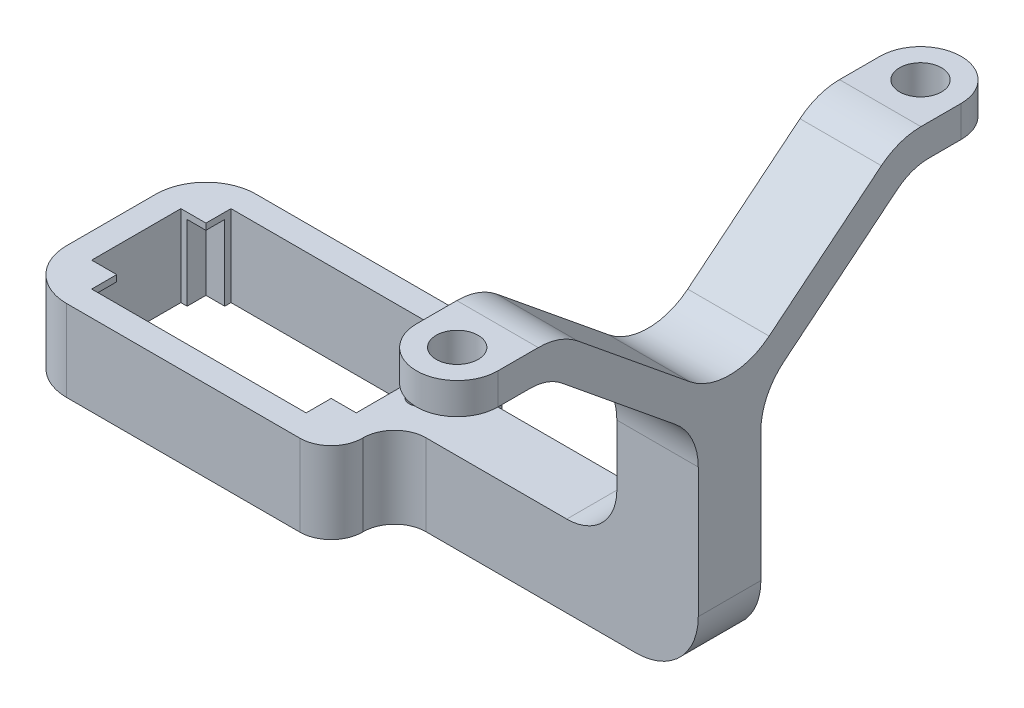
from build123d import *

# Parameters (mm, degrees)
BOSS_EXTRUDE1_DEPTH                   = 1
BOSS_EXTRUDE1_DEPTH_BACK              = 12
SKETCH1_W                             = 50.25
SKETCH1_H                             = 30.25
BOSS_EXTRUDE2_DEPTH                   = 5
BOSS_EXTRUDE3_DEPTH                   = 5
SKETCH4_R                             = 3.35
CUT_EXTRUDE1_DEPTH                    = 10
SKETCH6_W                             = 4
SKETCH6_H                             = 4
BOSS_EXTRUDE4_DEPTH                   = 1
TAP_DRILL_FOR_M4X0_7_TAP1_D           = 3.3
TAP_DRILL_FOR_M4X0_7_TAP1_CSINK_D     = 3.35
TAP_DRILL_FOR_M4X0_7_TAP1_CSINK_ANGLE = 90
SKETCH13_W                            = 13
SKETCH13_H                            = 54
CUT_EXTRUDE2_DEPTH                    = 22
BOSS_EXTRUDE5_DEPTH                   = 13
FILLET1_R                             = 10
FILLET2_R                             = 8
FILLET3_R                             = 5
FILLET4_R                             = 8


with BuildPart() as part:
    # Sketch1 → Boss-Extrude1 (new, two sides: drawn at the far end of the back side and taken through both)
    with BuildSketch(Plane(origin=(0, 20.13, 0), x_dir=(1, 0, 0), z_dir=(0, 1, 0)).offset(-BOSS_EXTRUDE1_DEPTH_BACK)):
        Rectangle(SKETCH1_W, SKETCH1_H)
        Polygon((20.125, 10.125), (17.125, 10.125), (17.125, 11.125), (-17.125, 11.125), (-17.125, 10.125), (-20.125, 10.125), (-20.125, 7.125), (-21.125, 7.125), (-21.125, -7.125), (-20.125, -7.125), (-20.125, -10.125), (-17.125, -10.125), (-17.125, -11.125), (17.125, -11.125), (17.125, -10.125), (20.125, -10.125), (20.125, -7.125), (21.125, -7.125), (21.125, 7.125), (20.125, 7.125), align=None, mode=Mode.SUBTRACT)
    extrude(amount=BOSS_EXTRUDE1_DEPTH + BOSS_EXTRUDE1_DEPTH_BACK)

    # Sketch2 → Boss-Extrude2 (add, symmetric)
    with BuildSketch(Plane.XY):
        Polygon((25.125, 21.13), (60.625, 21.13), (60.625, 68.13), (73.625, 68.13), (73.625, 8.13), (25.125, 8.13), align=None)
    extrude(amount=BOSS_EXTRUDE2_DEPTH, both=True)

    # Sketch3 → Boss-Extrude3 (add)
    with BuildSketch(Plane(origin=(0, 68.13, 0), x_dir=(1, 0, 0), z_dir=(0, 1, 0))):
        with BuildLine():
            Line((73.625, 5), (73.625, 37))
            ThreePointArc((73.625, 37), (67.125, 43.5), (60.625, 37))
            Line((60.625, 37), (60.625, 5))
            Line((60.625, 5), (73.625, 5))
        make_face()
        with BuildLine():
            Line((73.625, -37), (73.625, -5))
            Line((73.625, -5), (60.625, -5))
            Line((60.625, -5), (60.625, -37))
            ThreePointArc((60.625, -37), (67.125, -43.5), (73.625, -37))
        make_face()
    extrude(amount=-BOSS_EXTRUDE3_DEPTH)

    # Sketch4 → Cut-Extrude1 (cut)
    with BuildSketch(Plane.XZ.offset(-63.13)):
        with Locations(Location((67.125, 37, 0), (0, 0, 270))):
            Circle(SKETCH4_R)
        with Locations(Location((67.125, -37, 0), (0, 0, 270))):
            Circle(SKETCH4_R)
    extrude(amount=-CUT_EXTRUDE1_DEPTH, mode=Mode.SUBTRACT)

    # Sketch6 → Boss-Extrude4 (add)
    with BuildSketch(Plane(origin=(0, 21.13, 0), x_dir=(1, 0, 0), z_dir=(0, 1, 0))):
        with Locations((19.125, 9.125)):
            Rectangle(SKETCH6_W, SKETCH6_H)
        with Locations((19.125, -9.125)):
            Rectangle(SKETCH6_W, SKETCH6_H)
        with Locations((-19.125, -9.125)):
            Rectangle(SKETCH6_W, SKETCH6_H)
        with Locations((-19.125, 9.125)):
            Rectangle(SKETCH6_W, SKETCH6_H)
    extrude(amount=-BOSS_EXTRUDE4_DEPTH)

    # Tap Drill for M4x0.7 Tap1 (through all)
    with Locations(Plane(origin=(0, 8.13, 0), x_dir=(-1, 0, 0), z_dir=(0, -1, 0))):
        with Locations((-24.125, 0)):
            CounterSinkHole(TAP_DRILL_FOR_M4X0_7_TAP1_D / 2, TAP_DRILL_FOR_M4X0_7_TAP1_CSINK_D / 2, counter_sink_angle=TAP_DRILL_FOR_M4X0_7_TAP1_CSINK_ANGLE)

    # Sketch13 → Cut-Extrude2 (cut)
    with BuildSketch(Plane(origin=(0, 68.13, 0), x_dir=(1, 0, 0), z_dir=(0, 1, 0))):
        with Locations((67.125, 0)):
            Rectangle(SKETCH13_W, SKETCH13_H)
    extrude(amount=-CUT_EXTRUDE2_DEPTH, mode=Mode.SUBTRACT)


with BuildPart() as cut_extrude2_piece_1:
    # of the separate pieces the step leaves, piece 1, a body of its own (cut_extrude2_pieces)
    add(part.part.solids().sort_by_distance((25.125, 21.13, 15.125))[0])



with BuildPart() as cut_extrude2_piece_2:
    # of the separate pieces the step leaves, piece 2, a body of its own (cut_extrude2_pieces)
    add(part.part.solids().sort_by_distance((73.625, 68.13, 27))[0])


with BuildPart() as cut_extrude2_piece_3:
    # of the separate pieces the step leaves, piece 3, a body of its own (cut_extrude2_pieces)
    add(part.part.solids().sort_by_distance((73.625, 63.13, -27))[0])


with BuildPart() as cut_extrude2_piece_1_1:
    add(cut_extrude2_piece_1.part)

    add(cut_extrude2_piece_2.part)  # Boss-Extrude5 merges Cut-Extrude2 piece 2

    add(cut_extrude2_piece_3.part)  # Boss-Extrude5 merges Cut-Extrude2 piece 3
    # Sketch14 → Boss-Extrude5 (add)
    with BuildSketch(Plane(origin=(73.625, 0, 0), x_dir=(0, 0, -1), z_dir=(1, 0, 0))):
        Polygon((29, 63.13), (27, 63.13), (27, 68.13), (0, 46.13), (5, 46.13), (5, 43.574444444), align=None)
        Polygon((-5, 46.13), (0, 46.13), (-27, 68.13), (-27, 63.13), (-29, 63.13), (-5, 43.574444444), align=None)
    extrude(amount=-BOSS_EXTRUDE5_DEPTH)

    # Fillet1
    fillet1_edges = [cut_extrude2_piece_1_1.edges().sort_by_distance(p)[0] for p in [
        (73.625, 8.13, 0),
        (67.125, 43.574444444, -5),
        (67.125, 46.13, 0),
        (67.125, 68.13, -27),
        (67.125, 43.574444444, 5),
        (67.125, 68.13, 27),
    ]]
    fillet(fillet1_edges, radius=FILLET1_R)

    # Fillet2
    fillet2_edges = [cut_extrude2_piece_1_1.edges().sort_by_distance(p)[0] for p in [
        (67.125, 63.13, -29),
        (67.125, 63.13, 29),
    ]]
    fillet(fillet2_edges, radius=FILLET2_R)

    # Fillet3
    fillet3_edges = [cut_extrude2_piece_1_1.edges().sort_by_distance(p)[0] for p in [
        (25.125, 14.63, 5),
        (25.125, 14.63, 15.125),
        (25.125, 14.63, -5),
        (25.125, 14.63, -15.125),
    ]]
    fillet(fillet3_edges, radius=FILLET3_R)

    # Fillet4
    fillet4_edges = [cut_extrude2_piece_1_1.edges().sort_by_distance(p)[0] for p in [
        (60.625, 21.13, 0),
        (-25.125, 14.63, 15.125),
        (-25.125, 14.63, -15.125),
    ]]
    fillet(fillet4_edges, radius=FILLET4_R)


solid = cut_extrude2_piece_1_1.part
